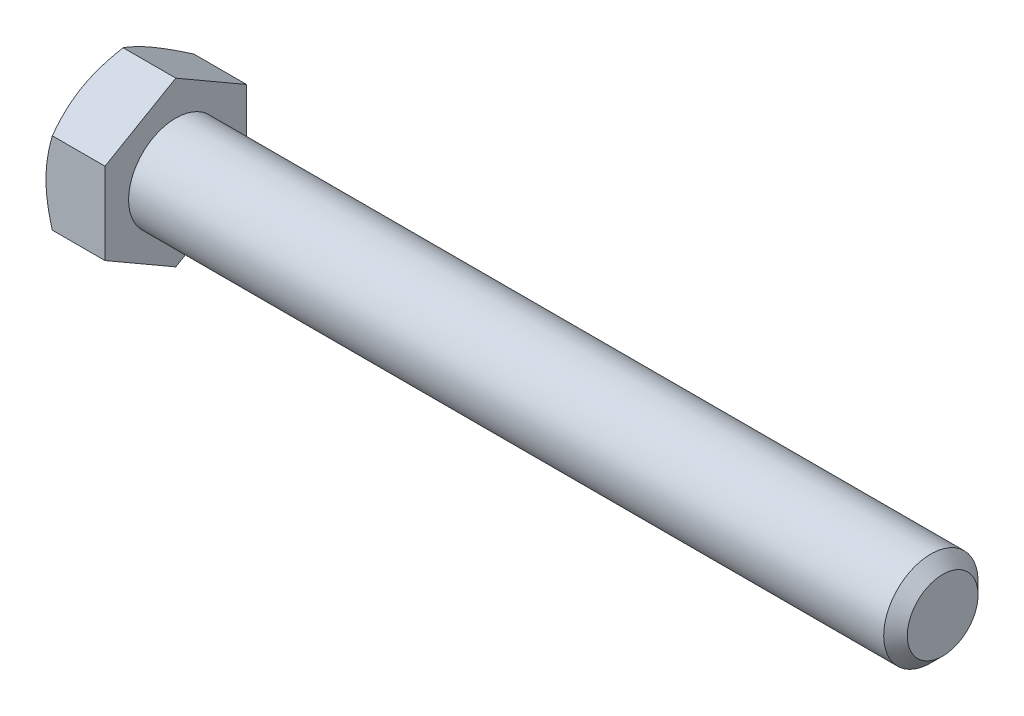
from build123d import *

# Parameters (mm, degrees)
BASEHEAD_DEPTH = 5
BEARINGSKE_W   = 0.8
BEARINGSKE_H   = 8.07179677


with BuildPart() as part:
    # HeadSke → BaseHead (new body)
    with BuildSketch(Plane(origin=(0, 0, 0), x_dir=(0, 0, -1), z_dir=(1, 0, 0))):
        Polygon((6, 3.464101615), (6, -3.464101615), (0, -6.92820323), (-6, -3.464101615), (-6, 3.464101615), (0, 6.92820323), align=None)
    extrude(amount=BASEHEAD_DEPTH)

    # BodySke → BaseBody (revolve)
    with BuildSketch(Plane.XY, mode=Mode.PRIVATE) as basebody_sk:
        Polygon((0, 0), (70, 0), (70, 3), (69, 4), (0, 4), align=None)
    revolve(basebody_sk.sketch.rotate(Axis((0, 0, 0), (1, 0, 0)), 90), axis=Axis((0, 0, 0), (1, 0, 0)))

    # Sketch3 → HeadChamfer (revolve, cut)
    with BuildSketch(Plane(origin=(0, 0, 0), x_dir=(1, 0, 0), z_dir=(0, 1, 0))):
        Polygon((1.5, 8.598076211), (-1.5, 3.401923789), (-13.554766255, 10.361746331), (-10.554766255, 15.557898754), align=None)
    revolve(axis=Axis((0, 0, 0), (1, 0, 0)), mode=Mode.SUBTRACT)

    # BearingSke → BearingFace (revolve, cut)
    with BuildSketch(Plane.XY):
        with Locations((4.6, 10.964101615)):
            Rectangle(BEARINGSKE_W, BEARINGSKE_H)
    revolve(axis=Axis((0, 0, 0), (1, 0, 0)), mode=Mode.SUBTRACT)


solid = part.part
